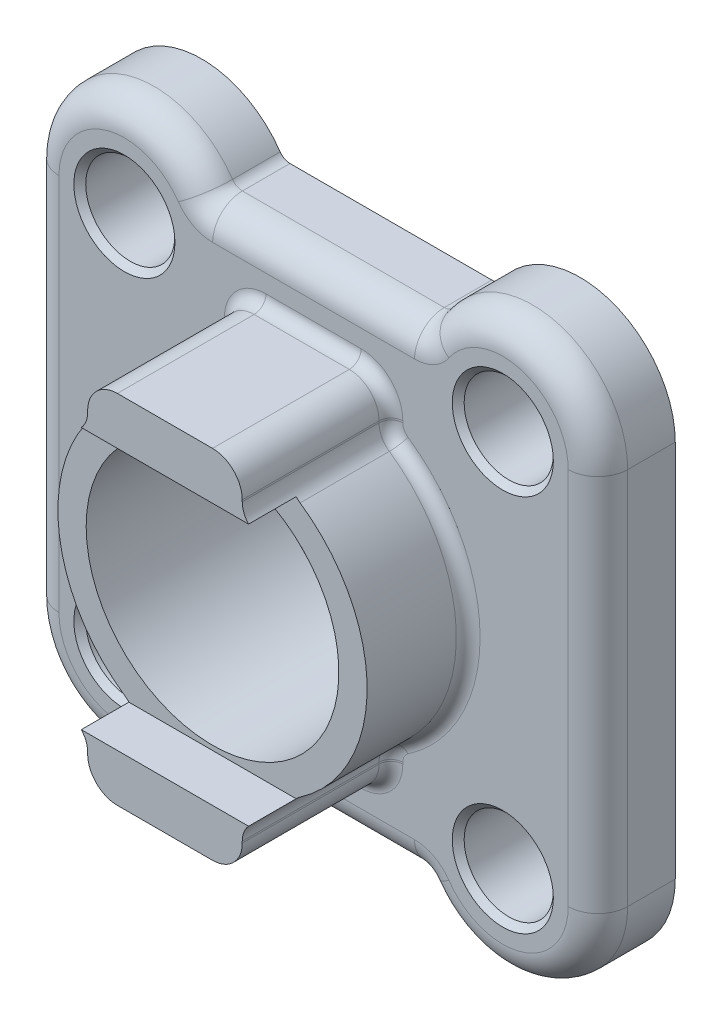
from build123d import *

# Parameters (mm, degrees)
SKETCH_1_R          = 21.25
SKETCH_1_R_2        = 7.5
EXTRUDE_1_DEPTH     = 13
SKETCH_2_R          = 21.25
EXTRUDE_4_DEPTH     = 25
CUT_EXTRUDE_START   = -8
CUT_EXTRUDE_4_DEPTH = 8
FILLET_5_R          = 2
FILLET_6_R          = 5
CHAMFER_1_SIZE      = 1


with BuildPart() as part:
    # Эскиз1 → Бобышка-Вытянуть1 (new body)
    with BuildSketch(Plane.XY):
        with BuildLine():
            Line((-18.069008367, 40), (18.069008367, 40))
            ThreePointArc((18.069008367, 40), (36.061694556, 47.247260365), (47.819805153, 31.819805153))
            Line((47.819805153, 31.819805153), (47.819805153, -31.819805153))
            ThreePointArc((47.819805153, -31.819805153), (36.061694556, -47.247260365), (18.069008367, -40))
            Line((18.069008367, -40), (-18.069008367, -40))
            ThreePointArc((-18.069008367, -40), (-36.061694556, -47.247260365), (-47.819805153, -31.819805153))
            Line((-47.819805153, -31.819805153), (-47.819805153, 31.819805153))
            ThreePointArc((-47.819805153, 31.819805153), (-36.061694556, 47.247260365), (-18.069008367, 40))
        make_face()
        with Locations(Location((0, 0, 0), (0, 0, 180))):
            Circle(SKETCH_1_R, mode=Mode.SUBTRACT)
        with Locations(Location((-31.819805153, 31.819805153, 0), (0, 0, 180))):
            Circle(SKETCH_1_R_2, mode=Mode.SUBTRACT)
        with Locations(Location((31.819805153, 31.819805153, 0), (0, 0, 180))):
            Circle(SKETCH_1_R_2, mode=Mode.SUBTRACT)
        with Locations(Location((31.819805153, -31.819805153, 0), (0, 0, 180))):
            Circle(SKETCH_1_R_2, mode=Mode.SUBTRACT)
        with Locations(Location((-31.819805153, -31.819805153, 0), (0, 0, 180))):
            Circle(SKETCH_1_R_2, mode=Mode.SUBTRACT)
    extrude(amount=EXTRUDE_1_DEPTH)

    # Эскиз2 → Бобышка-Вытянуть4 (add)
    with BuildSketch(Plane.XY.offset(13)):
        with BuildLine():
            Line((8, -30), (-8, -30))
            ThreePointArc((-8, -30), (-11.535533906, -28.535533906), (-13, -25))
            Line((-13, -25), (-13, -24.718414189))
            ThreePointArc((-13, -24.718414189), (-13.459755187, -22.856515516), (-14.733333333, -21.42262563))
            ThreePointArc((-14.733333333, -21.42262563), (-26, 0), (-14.733333333, 21.42262563))
            ThreePointArc((-14.733333333, 21.42262563), (-13.459755187, 22.856515516), (-13, 24.718414189))
            Line((-13, 24.718414189), (-13, 25))
            ThreePointArc((-13, 25), (-11.535533906, 28.535533906), (-8, 30))
            Line((-8, 30), (8, 30))
            ThreePointArc((8, 30), (11.535533906, 28.535533906), (13, 25))
            Line((13, 25), (13, 24.718414189))
            ThreePointArc((13, 24.718414189), (13.459755187, 22.856515516), (14.733333333, 21.42262563))
            ThreePointArc((14.733333333, 21.42262563), (26, 0), (14.733333333, -21.42262563))
            ThreePointArc((14.733333333, -21.42262563), (13.459755187, -22.856515516), (13, -24.718414189))
            Line((13, -24.718414189), (13, -25))
            ThreePointArc((13, -25), (11.535533906, -28.535533906), (8, -30))
        make_face()
        with Locations(Location((0, 0, 0), (0, 0, 180))):
            Circle(SKETCH_2_R, mode=Mode.SUBTRACT)
    extrude(amount=EXTRUDE_4_DEPTH)

    # Эскиз3 → Вырез-Вытянуть4 (cut)
    with BuildSketch(Plane.XY.offset(38).offset(CUT_EXTRUDE_START)):
        with BuildLine():
            Line((-14.06568163, 22), (14.06568163, 22))
            ThreePointArc((14.06568163, 22), (14.383532605, 21.692840132), (14.733333333, 21.42262563))
            ThreePointArc((14.733333333, 21.42262563), (26, 0), (14.733333333, -21.42262563))
            ThreePointArc((14.733333333, -21.42262563), (14.383532605, -21.692840132), (14.06568163, -22))
            Line((14.06568163, -22), (-14.06568163, -22))
            ThreePointArc((-14.06568163, -22), (-14.383532605, -21.692840132), (-14.733333333, -21.42262563))
            ThreePointArc((-14.733333333, -21.42262563), (-26, 0), (-14.733333333, 21.42262563))
            ThreePointArc((-14.733333333, 21.42262563), (-14.383532605, 21.692840132), (-14.06568163, 22))
        make_face()
    extrude(amount=CUT_EXTRUDE_4_DEPTH, mode=Mode.SUBTRACT)

    # Скругление5
    fillet_5_edges = [part.edges().sort_by_distance(p)[0] for p in [
        (18.069008367, -40, 6.5),
        (-18.069008367, -40, 6.5),
        (-18.069008367, 40, 6.5),
        (18.069008367, 40, 6.5),
        (11.535533906, -28.535533906, 13),
        (13, -24.859207094, 13),
        (13.459755187, -22.856515516, 13),
        (26, 0, 13),
        (13.459755187, 22.856515516, 13),
        (13, 24.859207094, 13),
        (11.535533906, 28.535533906, 13),
        (0, 30, 13),
        (-11.535533906, 28.535533906, 13),
        (-13, 24.859207094, 13),
        (-13.459755187, 22.856515516, 13),
        (-26, 0, 13),
        (-13.459755187, -22.856515516, 13),
        (-13, -24.859207094, 13),
        (-11.535533906, -28.535533906, 13),
        (0, -30, 13),
    ]]
    fillet(fillet_5_edges, radius=FILLET_5_R)

    # Скругление6
    fillet_6_edges = [part.edges().sort_by_distance(p)[0] for p in [
        (0, 40, 13),
        (0, -40, 13),
        (-17.907285662, 40.230499291, 13),
        (17.907285662, 40.230499291, 13),
        (17.907285662, -40.230499291, 13),
        (-17.907285662, -40.230499291, 13),
        (47.819805153, 0, 13),
        (36.556686471, 47.102539051, 13),
        (-36.556686471, 47.102539051, 13),
        (-47.819805153, 0, 13),
        (-36.556686471, -47.102539051, 13),
        (36.556686471, -47.102539051, 13),
    ]]
    fillet(fillet_6_edges, radius=FILLET_6_R)

    # Фаска1
    chamfer_1_edges = [part.edges().sort_by_distance(p)[0] for p in [
        (-24.319805153, -31.819805153, 13),
        (39.319805153, -31.819805153, 13),
        (39.319805153, 31.819805153, 13),
        (-24.319805153, 31.819805153, 0),
        (39.319805153, 31.819805153, 0),
        (39.319805153, -31.819805153, 0),
        (-24.319805153, -31.819805153, 0),
        (-24.319805153, 31.819805153, 13),
    ]]
    chamfer(chamfer_1_edges, length=CHAMFER_1_SIZE)


solid = part.part
